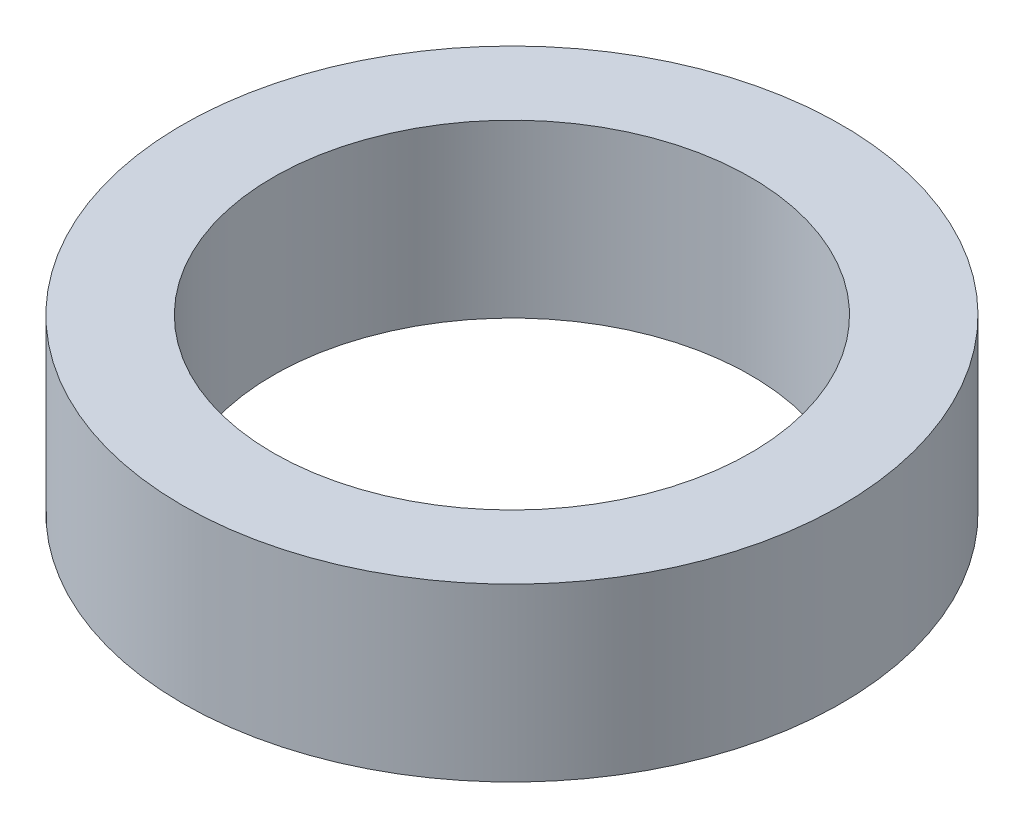
from build123d import *

# Parameters (mm, degrees)
SKETCH1_R           = 317.5
BOSS_EXTRUDE1_DEPTH = 165.1
SKETCH2_R           = 230
CUT_EXTRUDE1_DEPTH  = 479.404128327


with BuildPart() as part:
    # Sketch1 → Boss-Extrude1 (new body)
    with BuildSketch(Plane(origin=(0, 0, 0), x_dir=(1, 0, 0), z_dir=(0, 1, 0))):
        with Locations(Location((0, 0, 0), (0, 0, 270))):
            Circle(SKETCH1_R)
    extrude(amount=BOSS_EXTRUDE1_DEPTH)

    # Sketch2 → Cut-Extrude1 (cut, through all)
    with BuildSketch(Plane(origin=(0, 165.1, 0), x_dir=(1, 0, 0), z_dir=(0, 1, 0))):
        with Locations(Location((0, 0, 0), (0, 0, 270))):
            Circle(SKETCH2_R)
    extrude(amount=-CUT_EXTRUDE1_DEPTH, mode=Mode.SUBTRACT)


solid = part.part
